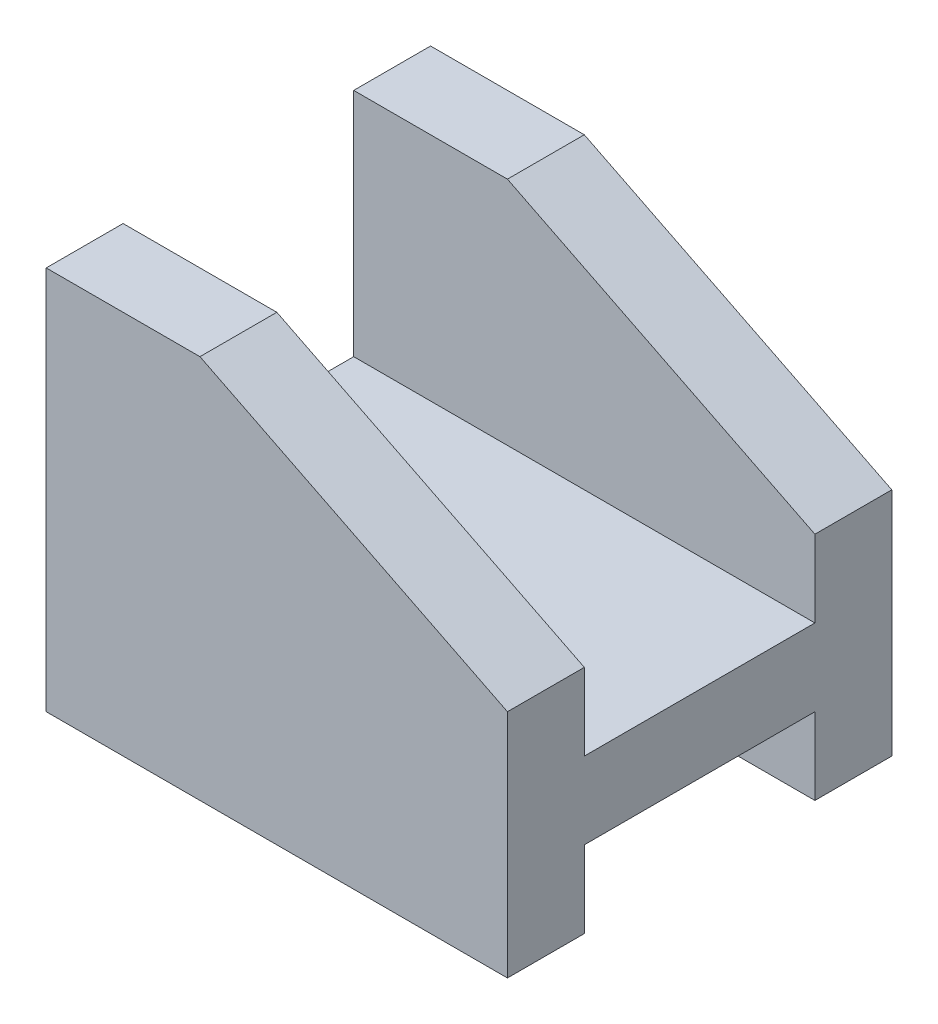
from build123d import *

# Parameters (mm, degrees)
SKETCH2_W               = 31.75
SKETCH2_H               = 31.75
BOSS_EXTRUDE2_DEPTH     = 19.05
CUT_EXTRUDE1_DEPTH      = 30.443738723
CUT_EXTRUDE1_DEPTH_BACK = 30.443738723
SKETCH4_W               = 19.05
SKETCH4_H               = 19.05
CUT_EXTRUDE2_DEPTH      = 30.443738723
CUT_EXTRUDE2_DEPTH_BACK = 30.443738723
SKETCH5_W               = 19.05
SKETCH5_H               = 6.35
CUT_EXTRUDE3_DEPTH      = 30.443738723
CUT_EXTRUDE3_DEPTH_BACK = 30.443738723


with BuildPart() as part:
    # Sketch2 → Boss-Extrude2 (new, symmetric)
    with BuildSketch(Plane(origin=(0, 0, 0), x_dir=(0, 0, -1), z_dir=(1, 0, 0))):
        Rectangle(SKETCH2_W, SKETCH2_H)
    extrude(amount=BOSS_EXTRUDE2_DEPTH, both=True)

    # Sketch4 → Cut-Extrude1 (cut, two sides: drawn at the far end of the back side and taken through both)
    with BuildSketch(Plane(origin=(0, 0, 0), x_dir=(0, 0, -1), z_dir=(1, 0, 0)).offset(-CUT_EXTRUDE1_DEPTH_BACK)):
        with Locations((0, 6.35)):
            Rectangle(SKETCH4_W, SKETCH4_H)
    extrude(amount=CUT_EXTRUDE1_DEPTH + CUT_EXTRUDE1_DEPTH_BACK, mode=Mode.SUBTRACT)

    # Sketch5 → Cut-Extrude2 (cut, two sides: drawn at the far end of the back side and taken through both)
    with BuildSketch(Plane(origin=(0, 0, 0), x_dir=(0, 0, -1), z_dir=(1, 0, 0)).offset(-CUT_EXTRUDE2_DEPTH_BACK)):
        with Locations((0, -12.7)):
            Rectangle(SKETCH5_W, SKETCH5_H)
    extrude(amount=CUT_EXTRUDE2_DEPTH + CUT_EXTRUDE2_DEPTH_BACK, mode=Mode.SUBTRACT)

    # Sketch6 → Cut-Extrude3 (cut, two sides: drawn at the far end of the back side and taken through both)
    with BuildSketch(Plane.XY.offset(-CUT_EXTRUDE3_DEPTH_BACK)):
        Polygon((19.05, 15.875), (19.05, 3.175), (-6.35, 15.875), align=None)
    extrude(amount=CUT_EXTRUDE3_DEPTH + CUT_EXTRUDE3_DEPTH_BACK, mode=Mode.SUBTRACT)


solid = part.part
